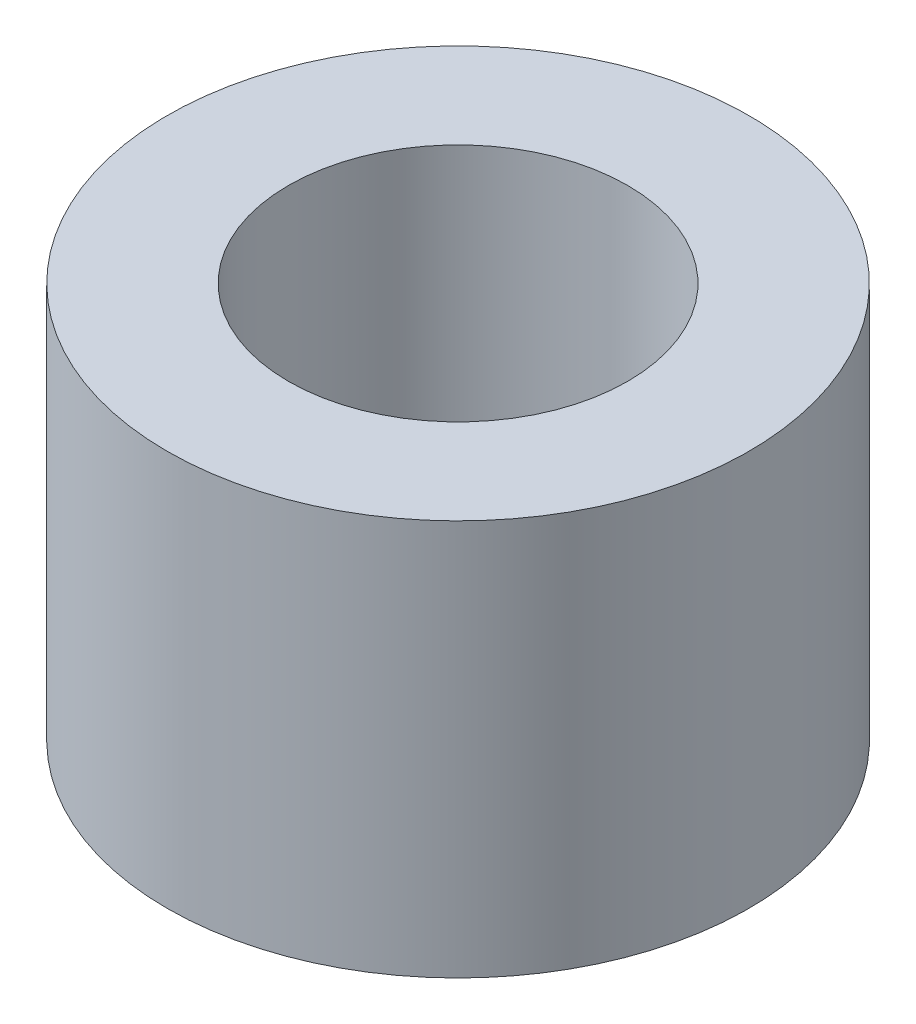
from build123d import *

# Parameters (mm, degrees)
SKETCH1_R           = 3.6
SKETCH1_R_2         = 2.1
BOSS_EXTRUDE1_DEPTH = 4.9


with BuildPart() as part:
    # Sketch1 → Boss-Extrude1 (new body)
    with BuildSketch(Plane(origin=(0, 0, 0), x_dir=(1, 0, 0), z_dir=(0, 1, 0))):
        with Locations(Location((0, 0, 0), (0, 0, 270))):
            Circle(SKETCH1_R)
        with Locations(Location((0, 0, 0), (0, 0, 270))):
            Circle(SKETCH1_R_2, mode=Mode.SUBTRACT)
    extrude(amount=BOSS_EXTRUDE1_DEPTH)


solid = part.part
